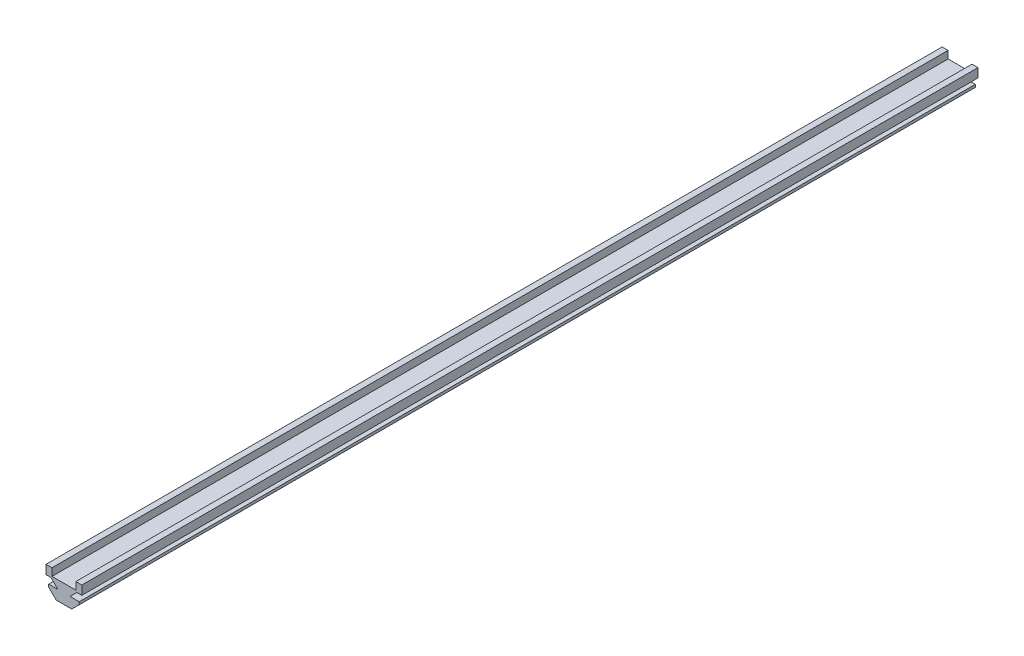
from build123d import *

# Parameters (mm, degrees)
SALIENTE_EXTRUIR1_DEPTH = 300


with BuildPart() as part:
    # Croquis1 → Saliente-Extruir1 (new body)
    with BuildSketch(Plane.XY):
        Polygon((7.372056275, -5.675), (10, -5.675), (10, 0.5), (6, 0.5), (6, 3), (4, 3), (4, 0), (4.4, 0), (4.95, 0), (5.657106781, 0), (7.957106781, -2.3), (4.9, -2.3), (4.9, -3.202943725), align=None)
        Polygon((10, -5.675), (12.627943725, -5.675), (15.1, -3.202943725), (15.1, -2.3), (12.042893219, -2.3), (14.342893219, 0), (16, 0), (16, 3), (14, 3), (14, 0.5), (10, 0.5), align=None)
    extrude(amount=SALIENTE_EXTRUIR1_DEPTH)


solid = part.part
